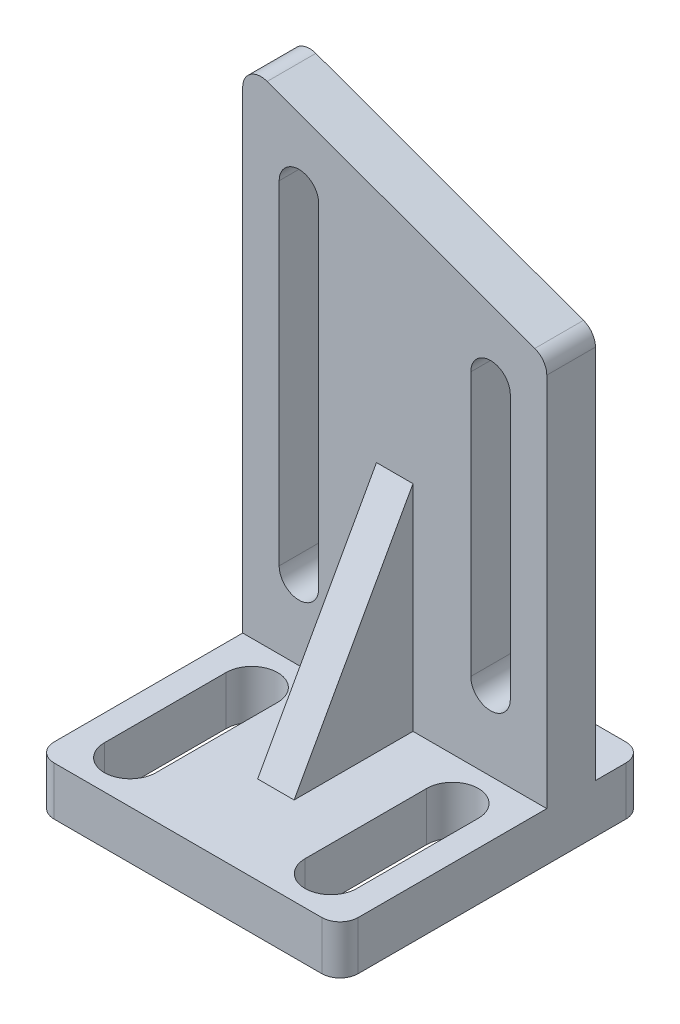
from build123d import *

# Parameters (mm, degrees)
SKETCH2_W           = 50
SKETCH2_H           = 50
BOSS_EXTRUDE1_DEPTH = 8
BOSS_EXTRUDE2_START = -8
BOSS_EXTRUDE2_DEPTH = 8
CUT_EXTRUDE2_DEPTH  = 8
BOSS_EXTRUDE3_START = -28
BOSS_EXTRUDE3_DEPTH = 6
CUT_EXTRUDE3_DEPTH  = 100.419585885
FILLET1_R           = 3


with BuildPart() as part:
    # Sketch2 → Boss-Extrude1 (new body)
    with BuildSketch(Plane(origin=(0, 0, 0), x_dir=(1, 0, 0), z_dir=(0, 1, 0))):
        Rectangle(SKETCH2_W, SKETCH2_H)
    extrude(amount=BOSS_EXTRUDE1_DEPTH)

    # Sketch5 → Boss-Extrude2 (add)
    with BuildSketch(Plane(origin=(0, 0, -25), x_dir=(-1, 0, 0), z_dir=(0, 0, -1)).offset(BOSS_EXTRUDE2_START)):
        Polygon((-25, 0), (-25, 71.819564568), (25, 90.018076282), (25, 0), align=None)
    extrude(amount=-BOSS_EXTRUDE2_DEPTH)

    # Sketch6 → Cut-Extrude2 (cut)
    with BuildSketch(Plane(origin=(0, 8, 0), x_dir=(1, 0, 0), z_dir=(0, 1, 0))):
        with BuildLine():
            Line((-12.25, 2), (-12.25, -18))
            ThreePointArc((-12.25, -18), (-16.5, -22.25), (-20.75, -18))
            Line((-20.75, -18), (-20.75, 2))
            ThreePointArc((-20.75, 2), (-16.5, 6.25), (-12.25, 2))
        make_face()
        with BuildLine():
            Line((12.25, 2), (12.25, -18))
            ThreePointArc((12.25, -18), (16.5, -22.25), (20.75, -18))
            Line((20.75, -18), (20.75, 2))
            ThreePointArc((20.75, 2), (16.5, 6.25), (12.25, 2))
        make_face()
    extrude(amount=-CUT_EXTRUDE2_DEPTH, mode=Mode.SUBTRACT)

    # Sketch7 → Boss-Extrude3 (add)
    with BuildSketch(Plane(origin=(25, 0, 0), x_dir=(0, 0, -1), z_dir=(1, 0, 0)).offset(BOSS_EXTRUDE3_START)):
        Polygon((9, 8), (-10.543361274, 8), (9, 43.271779749), align=None)
    extrude(amount=BOSS_EXTRUDE3_DEPTH)

    # Sketch8 → Cut-Extrude3 (cut, through all)
    with BuildSketch(Plane.XY.offset(-9)):
        with BuildLine():
            Line((-12.5, 75.401351615), (-12.5, 20.566768933))
            ThreePointArc((-12.5, 20.566768933), (-15.75, 17.316768933), (-19, 20.566768933))
            Line((-19, 20.566768933), (-19, 75.401351615))
            ThreePointArc((-19, 75.401351615), (-15.75, 78.651351615), (-12.5, 75.401351615))
        make_face()
        with BuildLine():
            Line((19, 63.936289235), (19, 20.566768933))
            ThreePointArc((19, 20.566768933), (15.75, 17.316768933), (12.5, 20.566768933))
            Line((12.5, 20.566768933), (12.5, 63.936289235))
            ThreePointArc((12.5, 63.936289235), (15.75, 67.186289235), (19, 63.936289235))
        make_face()
    extrude(amount=-CUT_EXTRUDE3_DEPTH, mode=Mode.SUBTRACT)

    # Fillet1
    fillet1_edges = [part.edges().sort_by_distance(p)[0] for p in [
        (-25, 90.018076282, -13),
        (25, 71.819564568, -13),
        (-25, 4, -25),
        (25, 4, -25),
        (25, 4, 25),
        (-25, 4, 25),
    ]]
    fillet(fillet1_edges, radius=FILLET1_R)


solid = part.part
